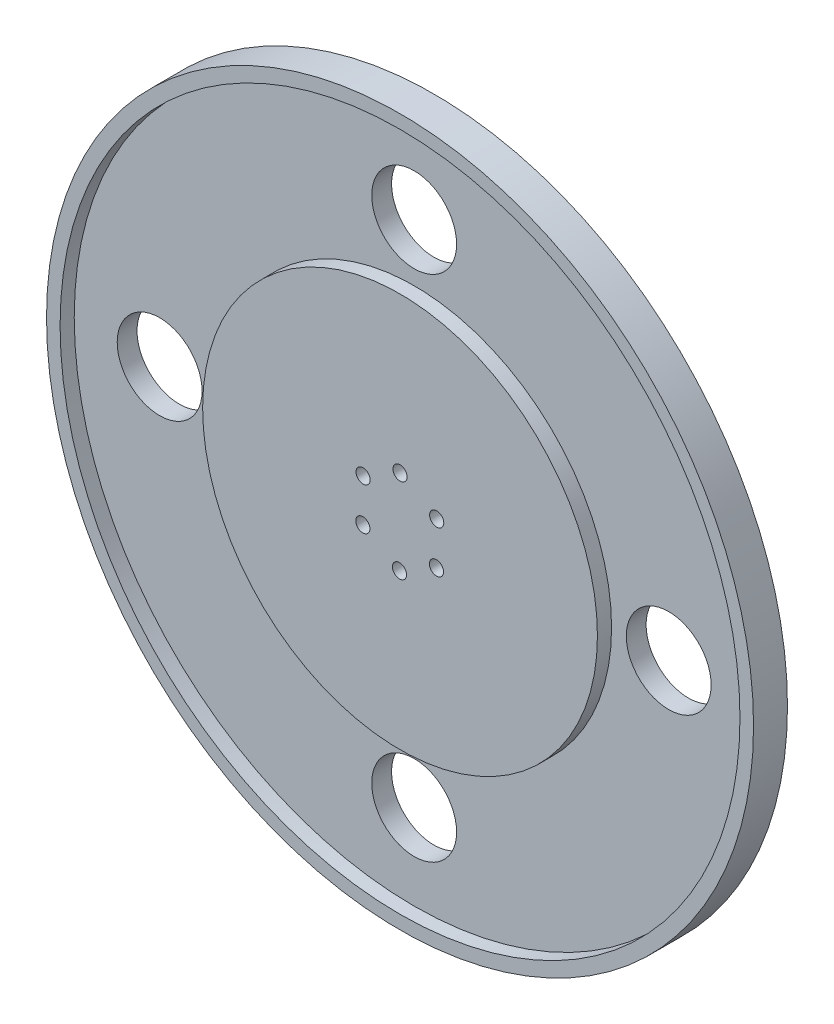
from build123d import *

# Parameters (mm, degrees)
SKETCH1_R             = 79.375
SKETCH1_R_2           = 76.327
BOSS_EXTRUDE1_DEPTH   = 7.62
SKETCH1_R_3           = 44.323
BOSS_EXTRUDE1_2_DEPTH = 7.62
SKETCH1_3_R           = 76.327
SKETCH1_3_R_2         = 44.323
BOSS_EXTRUDE2_DEPTH   = 4.445
CUT_EXTRUDE1_REACH    = 114.512
SKETCH2_R             = 9.525
CUT_EXTRUDE2_REACH    = 114.512
SKETCH4_R             = 1.5875


with BuildPart() as part:
    # Sketch1 → Boss-Extrude1 (new body)
    with BuildSketch(Plane.XY):
        Circle(SKETCH1_R)
        Circle(SKETCH1_R_2, mode=Mode.SUBTRACT)
    extrude(amount=BOSS_EXTRUDE1_DEPTH)



with BuildPart() as body_2:
    # Sketch1 → Boss-Extrude1 2 (new body)
    with BuildSketch(Plane.XY):
        Circle(SKETCH1_R_3)
    extrude(amount=BOSS_EXTRUDE1_2_DEPTH)


with BuildPart() as part_1:
    add(part.part)

    add(body_2.part)  # Boss-Extrude2 merges body 2
    # Sketch1<3> → Boss-Extrude2 (add)
    with BuildSketch(Plane.XY):
        Circle(SKETCH1_3_R)
        Circle(SKETCH1_3_R_2, mode=Mode.SUBTRACT)
    extrude(amount=BOSS_EXTRUDE2_DEPTH)

    # Sketch2 → Cut-Extrude1 (cut, up to next)
    with BuildSketch(Plane(origin=(0, 0, 0), x_dir=(-1, 0, 0), z_dir=(0, 0, -1)), mode=Mode.PRIVATE) as cut_extrude1_sk1:
        with Locations((57.15, 0)):
            Circle(SKETCH2_R)
    cut_extrude1_tool1 = extrude(cut_extrude1_sk1.sketch, amount=-CUT_EXTRUDE1_REACH, mode=Mode.PRIVATE) & part_1.part
    # Sketch2 → Cut-Extrude1 (cut, up to next)
    with BuildSketch(Plane(origin=(0, 0, 0), x_dir=(-1, 0, 0), z_dir=(0, 0, -1)), mode=Mode.PRIVATE) as cut_extrude1_sk2:
        with Locations((0, 57.15)):
            Circle(SKETCH2_R)
    cut_extrude1_tool2 = extrude(cut_extrude1_sk2.sketch, amount=-CUT_EXTRUDE1_REACH, mode=Mode.PRIVATE) & part_1.part
    # Sketch2 → Cut-Extrude1 (cut, up to next)
    with BuildSketch(Plane(origin=(0, 0, 0), x_dir=(-1, 0, 0), z_dir=(0, 0, -1)), mode=Mode.PRIVATE) as cut_extrude1_sk3:
        with Locations((0, -57.15)):
            Circle(SKETCH2_R)
    cut_extrude1_tool3 = extrude(cut_extrude1_sk3.sketch, amount=-CUT_EXTRUDE1_REACH, mode=Mode.PRIVATE) & part_1.part
    # Sketch2 → Cut-Extrude1 (cut, up to next)
    with BuildSketch(Plane(origin=(0, 0, 0), x_dir=(-1, 0, 0), z_dir=(0, 0, -1)), mode=Mode.PRIVATE) as cut_extrude1_sk4:
        with Locations((-57.15, 0)):
            Circle(SKETCH2_R)
    cut_extrude1_tool4 = extrude(cut_extrude1_sk4.sketch, amount=-CUT_EXTRUDE1_REACH, mode=Mode.PRIVATE) & part_1.part
    add(cut_extrude1_tool1.solids().sort_by_distance((-57.15, 0, 0))[0], mode=Mode.SUBTRACT)
    add(cut_extrude1_tool2.solids().sort_by_distance((0, 57.15, 0))[0], mode=Mode.SUBTRACT)
    add(cut_extrude1_tool3.solids().sort_by_distance((0, -57.15, 0))[0], mode=Mode.SUBTRACT)
    add(cut_extrude1_tool4.solids().sort_by_distance((57.15, 0, 0))[0], mode=Mode.SUBTRACT)

    # Sketch4 → Cut-Extrude2 (cut, up to next)
    with BuildSketch(Plane(origin=(0, 0, 0), x_dir=(-1, 0, 0), z_dir=(0, 0, -1)), mode=Mode.PRIVATE) as cut_extrude2_sk1:
        with Locations((0, 9.4996)):
            Circle(SKETCH4_R)
    cut_extrude2_tool1 = extrude(cut_extrude2_sk1.sketch, amount=-CUT_EXTRUDE2_REACH, mode=Mode.PRIVATE) & part_1.part
    # Sketch4 → Cut-Extrude2 (cut, up to next)
    with BuildSketch(Plane(origin=(0, 0, 0), x_dir=(-1, 0, 0), z_dir=(0, 0, -1)), mode=Mode.PRIVATE) as cut_extrude2_sk2:
        with Locations((8.293025278, 4.78147191)):
            Circle(SKETCH4_R)
    cut_extrude2_tool2 = extrude(cut_extrude2_sk2.sketch, amount=-CUT_EXTRUDE2_REACH, mode=Mode.PRIVATE) & part_1.part
    # Sketch4 → Cut-Extrude2 (cut, up to next)
    with BuildSketch(Plane(origin=(0, 0, 0), x_dir=(-1, 0, 0), z_dir=(0, 0, -1)), mode=Mode.PRIVATE) as cut_extrude2_sk3:
        with Locations((-8.232531424, 4.67669348)):
            Circle(SKETCH4_R)
    cut_extrude2_tool3 = extrude(cut_extrude2_sk3.sketch, amount=-CUT_EXTRUDE2_REACH, mode=Mode.PRIVATE) & part_1.part
    # Sketch4 → Cut-Extrude2 (cut, up to next)
    with BuildSketch(Plane(origin=(0, 0, 0), x_dir=(-1, 0, 0), z_dir=(0, 0, -1)), mode=Mode.PRIVATE) as cut_extrude2_sk4:
        with Locations((8.353519132, -4.759562701)):
            Circle(SKETCH4_R)
    cut_extrude2_tool4 = extrude(cut_extrude2_sk4.sketch, amount=-CUT_EXTRUDE2_REACH, mode=Mode.PRIVATE) & part_1.part
    # Sketch4 → Cut-Extrude2 (cut, up to next)
    with BuildSketch(Plane(origin=(0, 0, 0), x_dir=(-1, 0, 0), z_dir=(0, 0, -1)), mode=Mode.PRIVATE) as cut_extrude2_sk5:
        with Locations((-8.172037569, -4.86434113)):
            Circle(SKETCH4_R)
    cut_extrude2_tool5 = extrude(cut_extrude2_sk5.sketch, amount=-CUT_EXTRUDE2_REACH, mode=Mode.PRIVATE) & part_1.part
    # Sketch4 → Cut-Extrude2 (cut, up to next)
    with BuildSketch(Plane(origin=(0, 0, 0), x_dir=(-1, 0, 0), z_dir=(0, 0, -1)), mode=Mode.PRIVATE) as cut_extrude2_sk6:
        with Locations((0.120987709, -9.58246922)):
            Circle(SKETCH4_R)
    cut_extrude2_tool6 = extrude(cut_extrude2_sk6.sketch, amount=-CUT_EXTRUDE2_REACH, mode=Mode.PRIVATE) & part_1.part
    add(cut_extrude2_tool1.solids().sort_by_distance((0, 9.4996, 0))[0], mode=Mode.SUBTRACT)
    add(cut_extrude2_tool2.solids().sort_by_distance((-8.293025, 4.781472, 0))[0], mode=Mode.SUBTRACT)
    add(cut_extrude2_tool3.solids().sort_by_distance((8.232531, 4.676693, 0))[0], mode=Mode.SUBTRACT)
    add(cut_extrude2_tool4.solids().sort_by_distance((-8.353519, -4.759563, 0))[0], mode=Mode.SUBTRACT)
    add(cut_extrude2_tool5.solids().sort_by_distance((8.172038, -4.864341, 0))[0], mode=Mode.SUBTRACT)
    add(cut_extrude2_tool6.solids().sort_by_distance((-0.120988, -9.582469, 0))[0], mode=Mode.SUBTRACT)


solid = part_1.part
